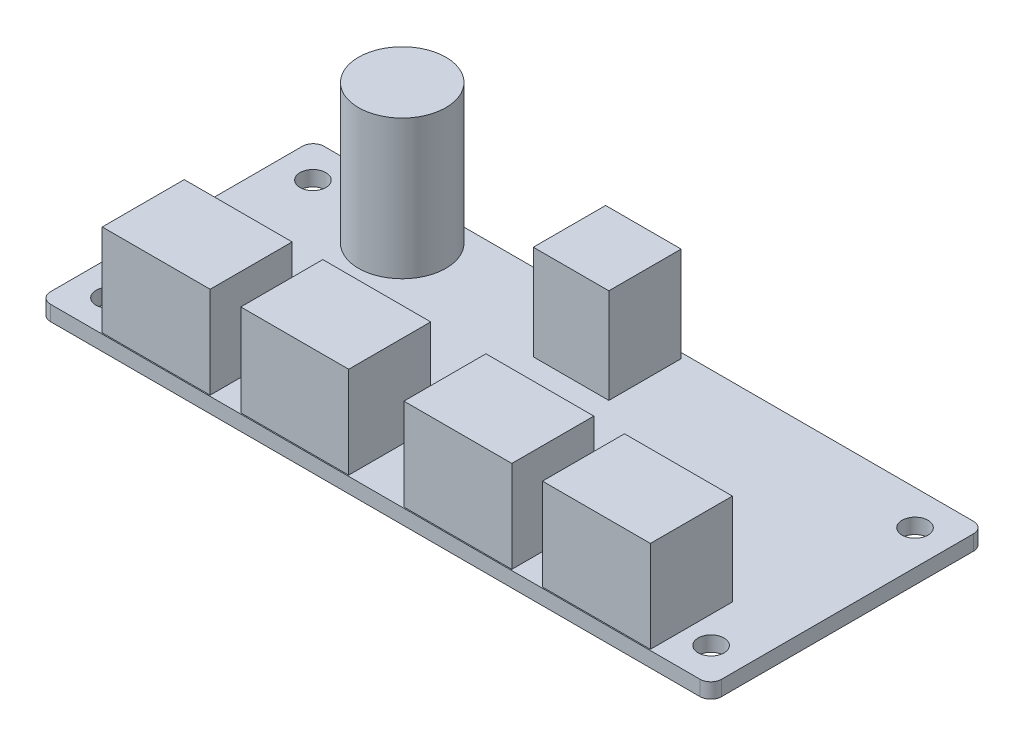
from build123d import *

# Parameters (mm, degrees)
SKETCH1_R           = 1.2
BOSS_EXTRUDE1_DEPTH = 1.4
SKETCH2_W           = 7
SKETCH2_H           = 6.7
BOSS_EXTRUDE2_DEPTH = 8.8
SKETCH3_W           = 10
SKETCH3_H           = 7.6
BOSS_EXTRUDE3_DEPTH = 8.5
SKETCH4_R           = 4.05
BOSS_EXTRUDE4_DEPTH = 12.9


with BuildPart() as part:
    # Sketch1 → Boss-Extrude1 (new body)
    with BuildSketch(Plane(origin=(0, 0, 0), x_dir=(1, 0, 0), z_dir=(0, 1, 0))):
        with BuildLine():
            Line((-30.1, -12.675), (30.1, -12.675))
            ThreePointArc((30.1, -12.675), (30.807106781, -12.382106781), (31.1, -11.675))
            Line((31.1, -11.675), (31.1, 11.675))
            ThreePointArc((31.1, 11.675), (30.807106781, 12.382106781), (30.1, 12.675))
            Line((30.1, 12.675), (-30.1, 12.675))
            ThreePointArc((-30.1, 12.675), (-30.807106781, 12.382106781), (-31.1, 11.675))
            Line((-31.1, 11.675), (-31.1, -11.675))
            ThreePointArc((-31.1, -11.675), (-30.807106781, -12.382106781), (-30.1, -12.675))
        make_face()
        with Locations(Location((-27.9, 9.45, 0), (0, 0, 270))):
            Circle(SKETCH1_R, mode=Mode.SUBTRACT)
        with Locations(Location((-27.9, -9.45, 0), (0, 0, 270))):
            Circle(SKETCH1_R, mode=Mode.SUBTRACT)
        with Locations(Location((27.9, -9.45, 0), (0, 0, 270))):
            Circle(SKETCH1_R, mode=Mode.SUBTRACT)
        with Locations(Location((27.9, 9.45, 0), (0, 0, 270))):
            Circle(SKETCH1_R, mode=Mode.SUBTRACT)
    extrude(amount=BOSS_EXTRUDE1_DEPTH)

    # Sketch2 → Boss-Extrude2 (add)
    with BuildSketch(Plane(origin=(0, 1.4, 0), x_dir=(1, 0, 0), z_dir=(0, 1, 0))):
        with Locations((0, 8.825)):
            Rectangle(SKETCH2_W, SKETCH2_H)
    extrude(amount=BOSS_EXTRUDE2_DEPTH)

    # Sketch3 → Boss-Extrude3 (add)
    with BuildSketch(Plane(origin=(0, 1.4, 0), x_dir=(1, 0, 0), z_dir=(0, 1, 0))):
        with Locations((-20.4, -8.775)):
            Rectangle(SKETCH3_W, SKETCH3_H)
        with Locations((-7.56, -8.775)):
            Rectangle(SKETCH3_W, SKETCH3_H)
    boss_extrude3 = extrude(amount=BOSS_EXTRUDE3_DEPTH)

    # Mirror1: Boss-Extrude3 across plane
    add(boss_extrude3.mirror(Plane(origin=(0, 0, 0), x_dir=(0, 0, 1), z_dir=(1, 0, 0))))

    # Sketch4 → Boss-Extrude4 (add)
    with BuildSketch(Plane(origin=(0, 1.4, 0), x_dir=(1, 0, 0), z_dir=(0, 1, 0))):
        with Locations(Location((-18.7, 8.525, 0), (0, 0, 90))):
            Circle(SKETCH4_R)
    extrude(amount=BOSS_EXTRUDE4_DEPTH)


solid = part.part
